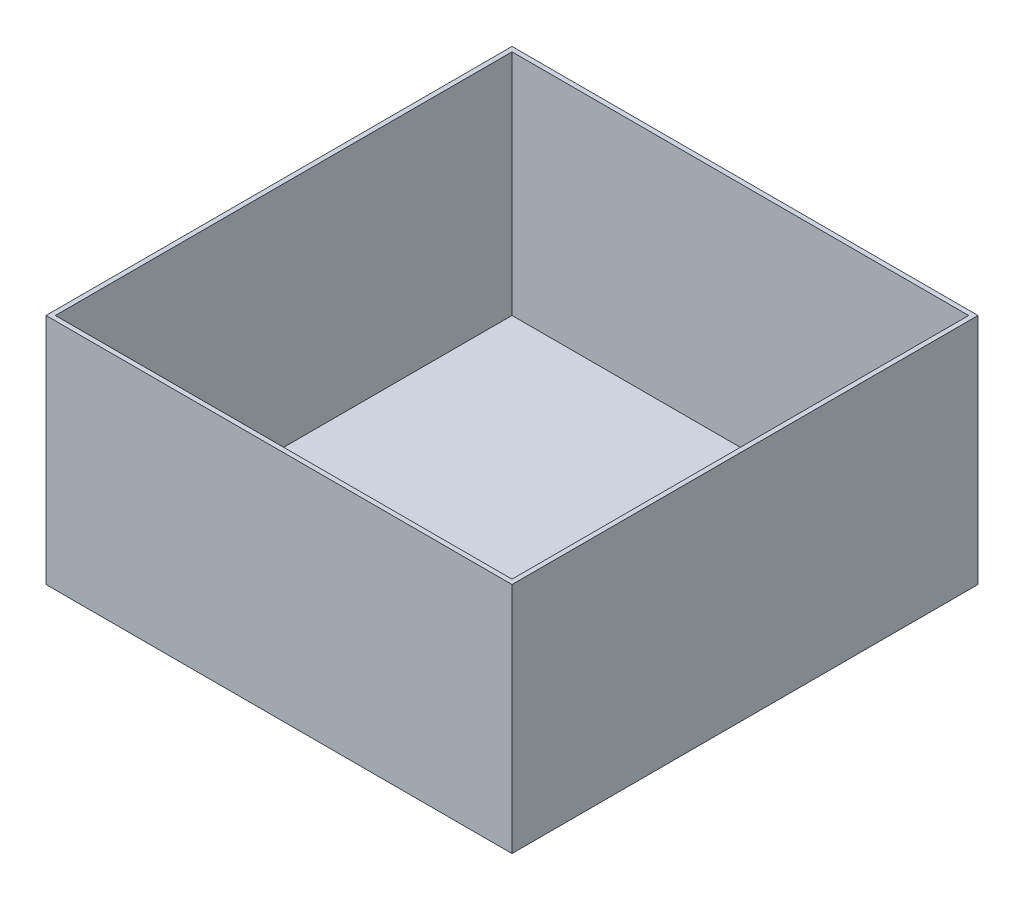
from build123d import *

# Parameters (mm, degrees)
SKETCH_1_W          = 1000
SKETCH_1_H          = 500
EXTRUDE_1_DEPTH     = 1000
SKETCH_2_W          = 980
SKETCH_2_H          = 980
CUT_EXTRUDE_1_DEPTH = 490


with BuildPart() as part:
    # 草图1 → 凸台-拉伸1 (new body)
    with BuildSketch(Plane.XY):
        Rectangle(SKETCH_1_W, SKETCH_1_H)
    extrude(amount=EXTRUDE_1_DEPTH)

    # 草图2 → 切除-拉伸1 (cut)
    with BuildSketch(Plane(origin=(0, 250, 0), x_dir=(1, 0, 0), z_dir=(0, 1, 0))):
        with Locations((0, -500)):
            Rectangle(SKETCH_2_W, SKETCH_2_H)
    extrude(amount=-CUT_EXTRUDE_1_DEPTH, mode=Mode.SUBTRACT)


solid = part.part
